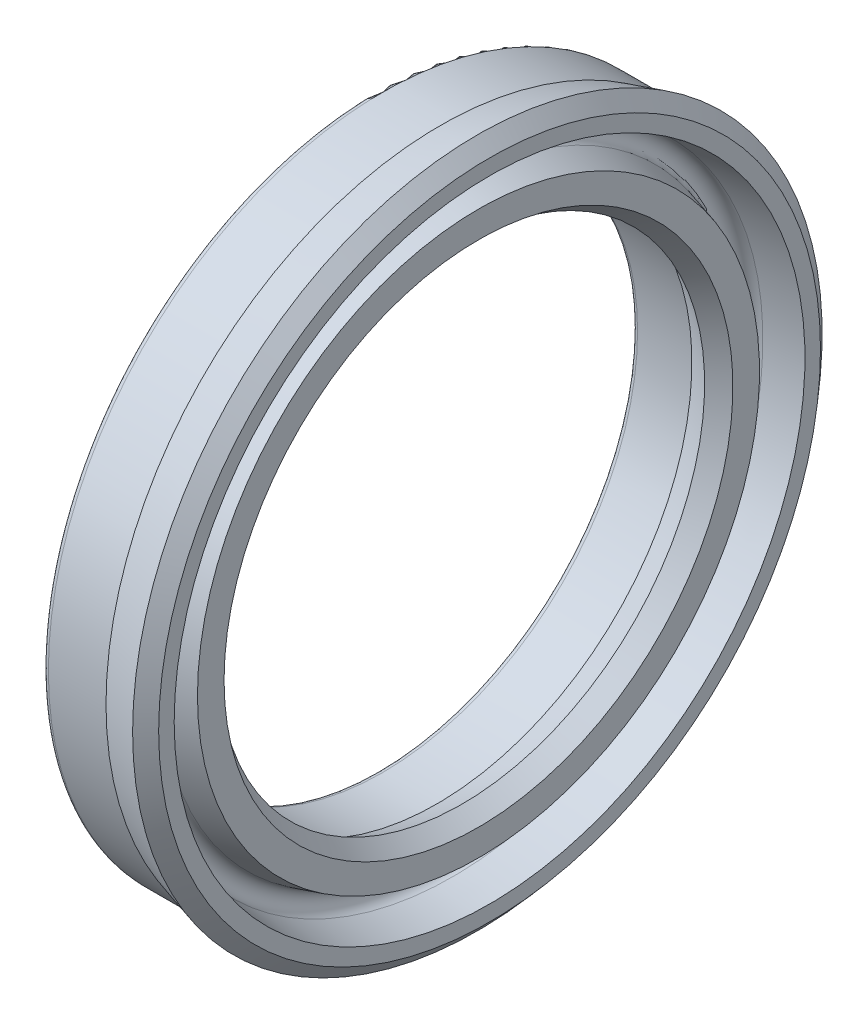
from build123d import *

# Parameters (mm, degrees)
FILLET1_R = 0.5


with BuildPart() as part:
    # Sketch1 → Revolve1 (revolve)
    with BuildSketch(Plane.XY, mode=Mode.PRIVATE) as revolve1_sk:
        with BuildLine():
            Line((0, 23), (0, 30.15))
            Line((0, 30.15), (5.7, 30.15))
            Line((5.7, 30.15), (9.05, 31.1))
            Line((9.05, 31.1), (10.15, 29.85))
            Line((10.15, 29.85), (10.15, 28.45))
            Line((10.15, 28.45), (6.813609391, 27.990655138))
            ThreePointArc((6.813609391, 27.990655138), (5.952260951, 27.067207064), (6.681984504, 26.036585399))
            Line((6.681984504, 26.036585399), (9.15, 25.35))
            Line((9.15, 25.35), (9.15, 22.95))
            Line((9.15, 22.95), (7.65, 21.9))
            Line((7.65, 21.9), (5.4, 23))
            Line((5.4, 23), (0, 23))
        make_face()
    revolve(revolve1_sk.sketch.rotate(Axis((0, 0, 0), (1, 0, 0)), 90), axis=Axis((0, 0, 0), (1, 0, 0)))

    # Fillet1
    fillet1_edges = [part.edges().sort_by_distance(p)[0] for p in [
        (0, 0, -30.15),
        (0, 0, -23),
    ]]
    fillet(fillet1_edges, radius=FILLET1_R)


solid = part.part
